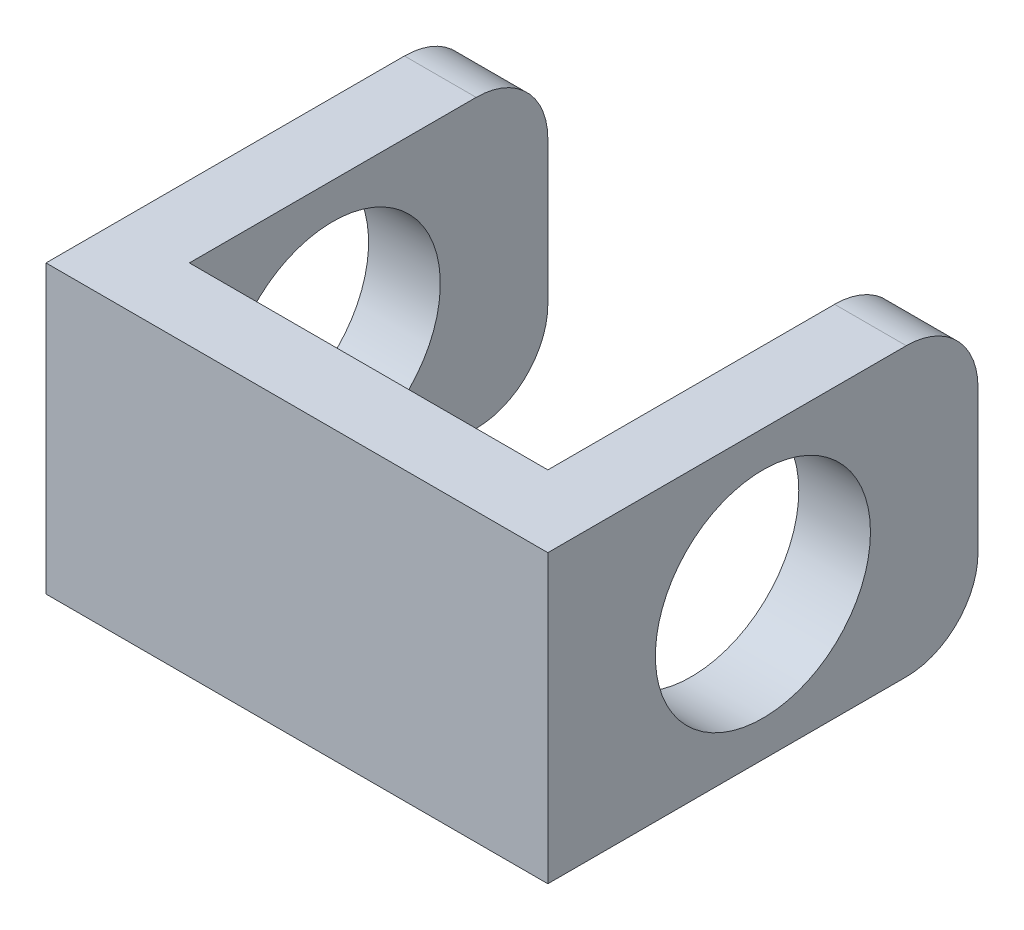
from build123d import *

# Parameters (mm, degrees)
SKETCH1_W           = 50
SKETCH1_H           = 40
BOSS_EXTRUDE1_DEPTH = 10
BOSS_EXTRUDE2_DEPTH = 10
BOSS_EXTRUDE3_DEPTH = 10
SKETCH4_W           = 70
SKETCH4_H           = 40
BOSS_EXTRUDE4_DEPTH = 10
CUT_EXTRUDE1_DEPTH  = 140


with BuildPart() as part:
    # Sketch1 → Boss-Extrude1 (new body)
    with BuildSketch(Plane.XY):
        with Locations((25, 20)):
            Rectangle(SKETCH1_W, SKETCH1_H)
    extrude(amount=BOSS_EXTRUDE1_DEPTH)

    # Sketch3 → Boss-Extrude3 (add)
    with BuildSketch(Plane(origin=(50, 0, 0), x_dir=(0, 0, -1), z_dir=(1, 0, 0))):
        with BuildLine():
            Line((-10, 40), (40, 40))
            ThreePointArc((40, 40), (47.071067812, 37.071067812), (50, 30))
            Line((50, 30), (50, 10))
            ThreePointArc((50, 10), (47.071067812, 2.928932188), (40, 0))
            Line((40, 0), (-10, 0))
            Line((-10, 0), (-10, 40))
        make_face()
    extrude(amount=BOSS_EXTRUDE3_DEPTH)



with BuildPart() as body_2:
    # Sketch2 → Boss-Extrude2 (new body)
    with BuildSketch(Plane(origin=(0, 0, 0), x_dir=(0, 0, -1), z_dir=(1, 0, 0))):
        with BuildLine():
            Line((0, 0), (40, 0))
            ThreePointArc((40, 0), (47.071067812, 2.928932188), (50, 10))
            Line((50, 10), (50, 30))
            ThreePointArc((50, 30), (47.071067812, 37.071067812), (40, 40))
            Line((40, 40), (0, 40))
            Line((0, 40), (0, 0))
        make_face()
    extrude(amount=-BOSS_EXTRUDE2_DEPTH)


with BuildPart() as part_1:
    add(part.part)

    add(body_2.part)  # Boss-Extrude4 merges body 2
    # Sketch4 → Boss-Extrude4 (add)
    with BuildSketch(Plane.XY.offset(10)):
        with Locations((25, 20)):
            Rectangle(SKETCH4_W, SKETCH4_H)
    extrude(amount=-BOSS_EXTRUDE4_DEPTH)

    # Sketch5 → Cut-Extrude1 (cut)
    with BuildSketch(Plane(origin=(60, 0, 0), x_dir=(0, 0, -1), z_dir=(1, 0, 0))):
        with BuildLine():
            Line((20, 20), (35, 20))
            ThreePointArc((35, 20), (30.606601718, 30.606601718), (20, 35))
            Line((20, 35), (20, 20))
        make_face()
        with BuildLine():
            Line((5, 20), (20, 20))
            Line((20, 20), (20, 35))
            ThreePointArc((20, 35), (9.393398282, 30.606601718), (5, 20))
        make_face()
        with BuildLine():
            ThreePointArc((20, 5), (30.606601718, 9.393398282), (35, 20))
            Line((35, 20), (20, 20))
            Line((20, 20), (20, 5))
        make_face()
        with BuildLine():
            Line((20, 5), (20, 20))
            Line((20, 20), (5, 20))
            ThreePointArc((5, 20), (9.393398282, 9.393398282), (20, 5))
        make_face()
    extrude(amount=-CUT_EXTRUDE1_DEPTH, mode=Mode.SUBTRACT)


solid = part_1.part
